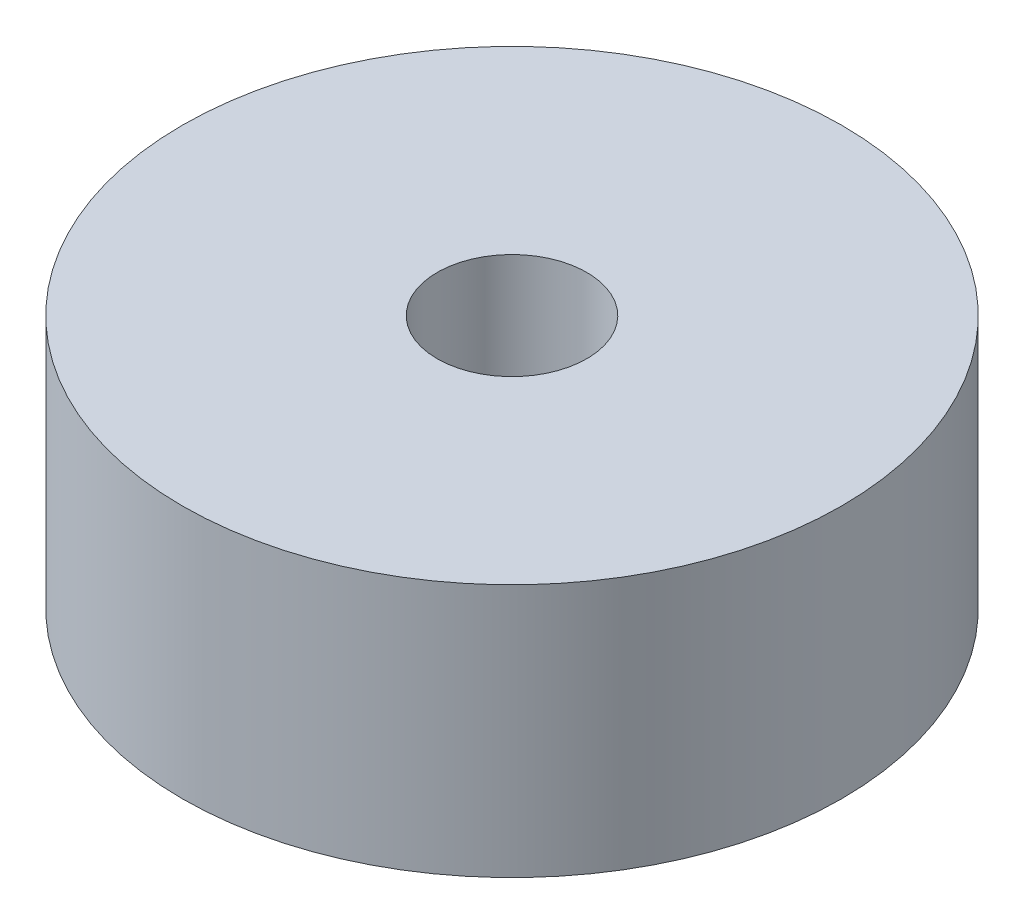
from build123d import *

# Parameters (mm, degrees)
SKETCH1_R           = 6.5
SKETCH1_R_2         = 1.475
BOSS_EXTRUDE1_DEPTH = 5


with BuildPart() as part:
    # Sketch1 → Boss-Extrude1 (new body)
    with BuildSketch(Plane(origin=(0, 0, 0), x_dir=(1, 0, 0), z_dir=(0, 1, 0))):
        with Locations(Location((0, 0, 0), (0, 0, 270))):
            Circle(SKETCH1_R)
        with Locations(Location((0, 0, 0), (0, 0, 270))):
            Circle(SKETCH1_R_2, mode=Mode.SUBTRACT)
    extrude(amount=BOSS_EXTRUDE1_DEPTH)


solid = part.part
